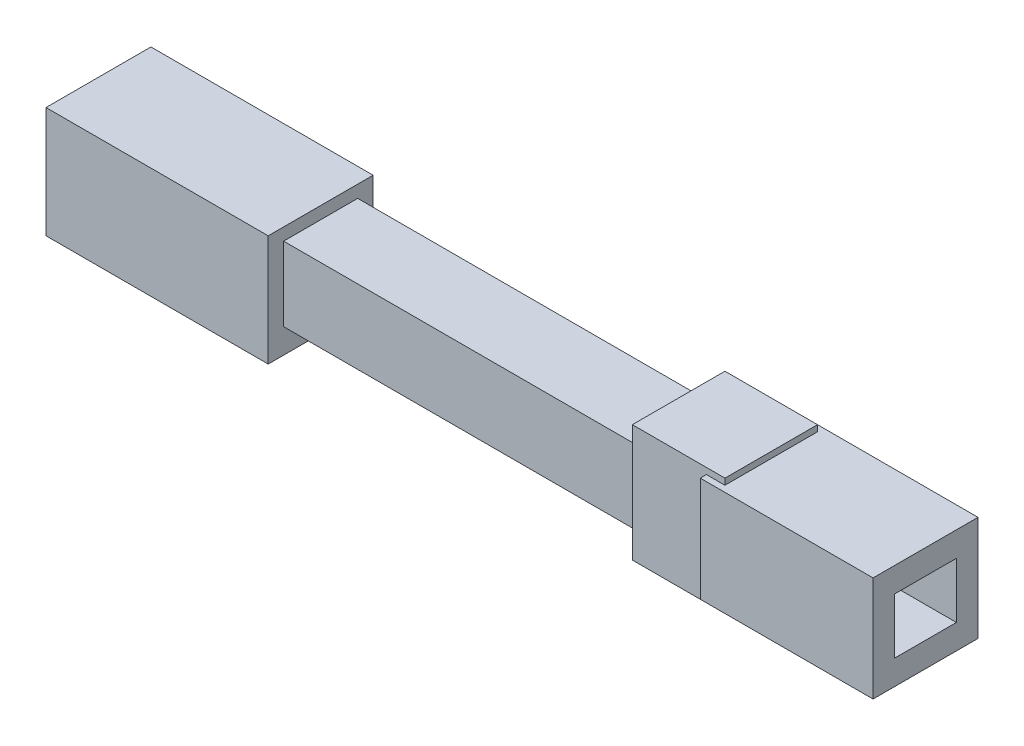
from build123d import *

# Parameters (mm, degrees)
SKETCH1_W           = 72
SKETCH1_H           = 36
BOSS_EXTRUDE1_DEPTH = 17
SKETCH2_W           = 124
SKETCH2_H           = 24
BOSS_EXTRUDE2_DEPTH = 12
SKETCH3_W           = 30
SKETCH3_H           = 38
BOSS_EXTRUDE3_DEPTH = 15
SKETCH4_W           = 56
SKETCH4_H           = 34
BOSS_EXTRUDE4_DEPTH = 17
SKETCH5_W           = 38
SKETCH5_H           = 18
CUT_EXTRUDE1_DEPTH  = 10
SKETCH6_R           = 7.25
CUT_EXTRUDE2_DEPTH  = 334.282162739
SKETCH7_R           = 7.5
CUT_EXTRUDE3_DEPTH  = 334.282162739


with BuildPart() as part:
    # Sketch1 → Boss-Extrude1 (new, symmetric)
    with BuildSketch(Plane.XY):
        with Locations((16, 200)):
            Rectangle(SKETCH1_W, SKETCH1_H)
    extrude(amount=BOSS_EXTRUDE1_DEPTH, both=True)

    # Sketch2 → Boss-Extrude2 (add, symmetric)
    with BuildSketch(Plane.XY):
        with Locations((110, 202)):
            Rectangle(SKETCH2_W, SKETCH2_H)
    extrude(amount=BOSS_EXTRUDE2_DEPTH, both=True)

    # Sketch3 → Boss-Extrude3 (add, symmetric)
    with BuildSketch(Plane.XY):
        with Locations((183, 203)):
            Rectangle(SKETCH3_W, SKETCH3_H)
    extrude(amount=BOSS_EXTRUDE3_DEPTH, both=True)

    # Sketch4 → Boss-Extrude4 (add, symmetric)
    with BuildSketch(Plane.XY):
        with Locations((220, 203)):
            Rectangle(SKETCH4_W, SKETCH4_H)
    extrude(amount=BOSS_EXTRUDE4_DEPTH, both=True)

    # Sketch5 → Cut-Extrude1 (cut, symmetric)
    with BuildSketch(Plane.XY):
        with Locations((233, 203)):
            Rectangle(SKETCH5_W, SKETCH5_H)
    extrude(amount=CUT_EXTRUDE1_DEPTH, both=True, mode=Mode.SUBTRACT)

    # Sketch6 → Cut-Extrude2 (cut, through all)
    with BuildSketch(Plane.XY):
        with Locations((0, 198)):
            Circle(SKETCH6_R)
    extrude(amount=-CUT_EXTRUDE2_DEPTH, mode=Mode.SUBTRACT)

    # Sketch7 → Cut-Extrude3 (cut, through all)
    with BuildSketch(Plane.XY):
        with Locations((110, 202)):
            Circle(SKETCH7_R)
    extrude(amount=-CUT_EXTRUDE3_DEPTH, mode=Mode.SUBTRACT)


solid = part.part
